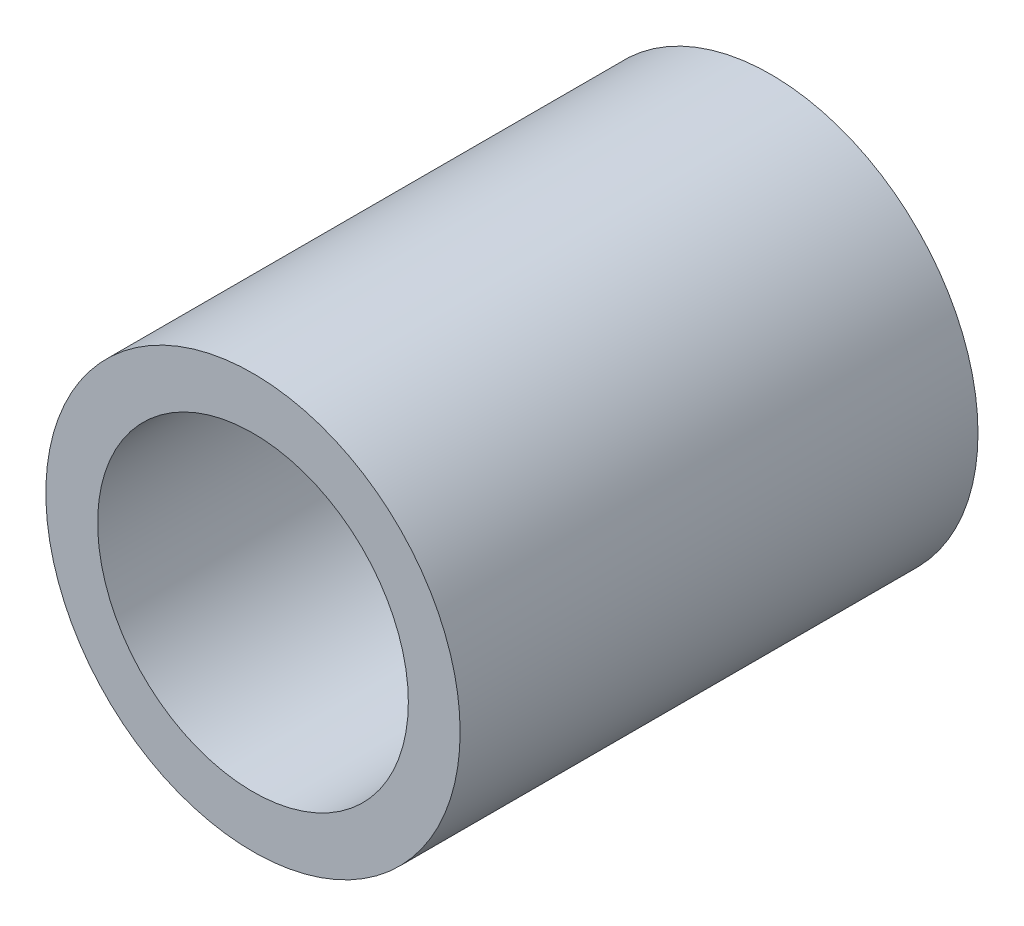
from build123d import *

# Parameters (mm, degrees)
ESQUISSE1_R        = 2
ESQUISSE1_R_2      = 1.5
BOSS_EXTRU_1_DEPTH = 5


with BuildPart() as part:
    # Esquisse1 → Boss.-Extru.1 (new body)
    with BuildSketch(Plane.XY):
        Circle(ESQUISSE1_R)
        Circle(ESQUISSE1_R_2, mode=Mode.SUBTRACT)
    extrude(amount=BOSS_EXTRU_1_DEPTH)


solid = part.part
